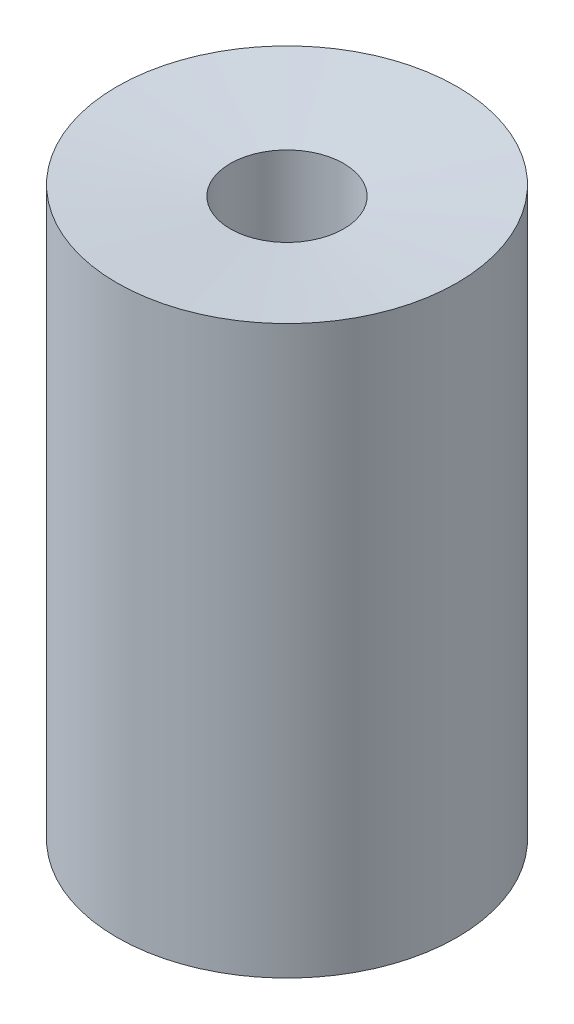
from build123d import *

# Parameters (mm, degrees)
SKETCH1_R      = 30
SKETCH1_R_2    = 10
EXTRUDE1_DEPTH = 100


with BuildPart() as part:
    # Sketch1 → Extrude1 (new body)
    with BuildSketch(Plane(origin=(0, 0, 0), x_dir=(1, 0, 0), z_dir=(0, 1, 0))):
        with Locations(Location((0, 0, 0), (0, 0, 270))):
            Circle(SKETCH1_R)
        with Locations(Location((0, 0, 0), (0, 0, 270))):
            Circle(SKETCH1_R_2, mode=Mode.SUBTRACT)
    extrude(amount=EXTRUDE1_DEPTH)

    # Sketch3 → Cut-Revolve1 (revolve, cut)
    with BuildSketch(Plane.XY, mode=Mode.PRIVATE) as cut_revolve1_sk:
        Polygon((-30, 100), (0, 97.375340094), (0, 100), align=None)
        Polygon((0, 2.624659906), (0, 0), (-30, 0), align=None)
    revolve(cut_revolve1_sk.sketch.rotate(Axis((0, 97.375340094, 0), (0, 1, 0)), 270), axis=Axis((0, 97.375340094, 0), (0, 1, 0)), mode=Mode.SUBTRACT)


solid = part.part
